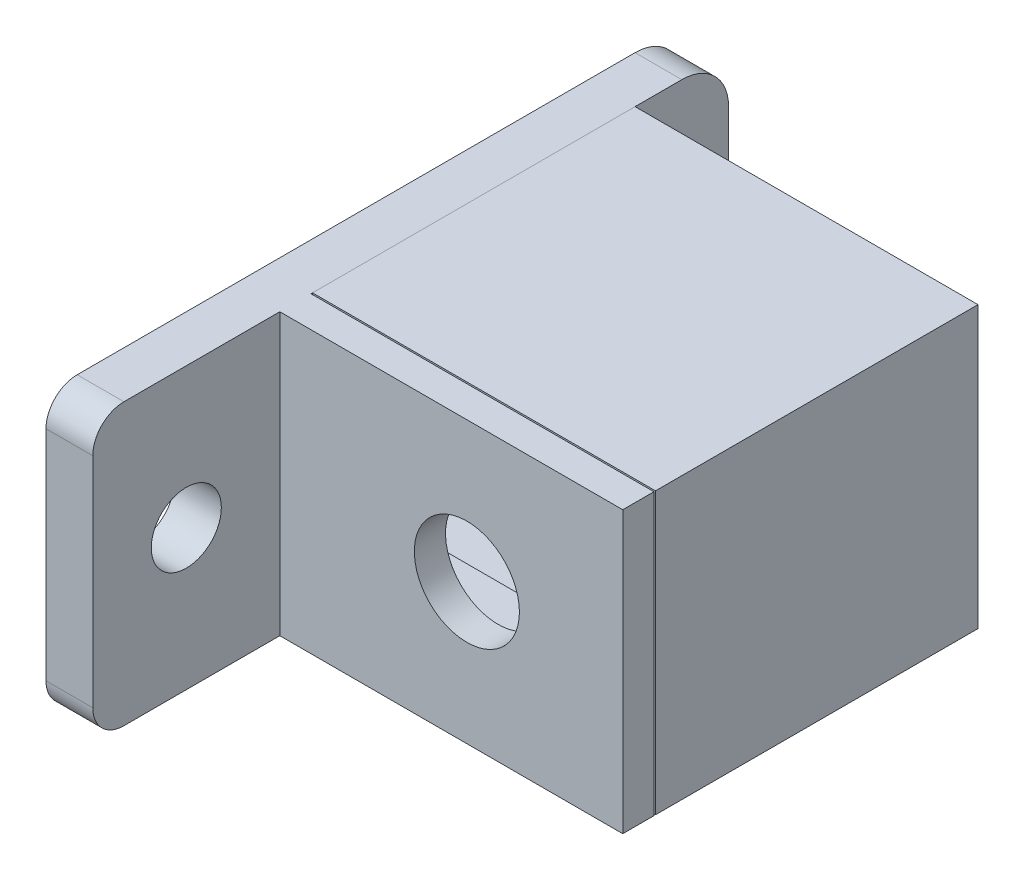
from build123d import *

# Parameters (mm, degrees)
BOSS_EXTRUDE1_DEPTH      = 10
BOSS_EXTRUDE1_DEPTH_BACK = 15
SKETCH1_W                = 2
SKETCH1_H                = 18
SKETCH2_W                = 3
SKETCH2_H                = 18
BOSS_EXTRUDE2_DEPTH      = 20.79
BOSS_EXTRUDE3_DEPTH      = 22
SKETCH6_W                = 20.69
SKETCH6_H                = 18
BOSS_EXTRUDE4_DEPTH      = 3
CUT_EXTRUDE1_DEPTH       = 19
BOSS_EXTRUDE5_DEPTH      = 18.5
SKETCH7_R                = 3.75
CUT_EXTRUDE2_DEPTH       = 29.729498777
SKETCH8_R                = 3.37
CUT_EXTRUDE3_DEPTH       = 29.729498777
BOSS_EXTRUDE6_DEPTH      = 3
SKETCH13_W               = 3
SKETCH13_H               = 12
BOSS_EXTRUDE7_DEPTH      = 3
BOSS_EXTRUDE8_DEPTH      = 3
SKETCH17_W               = 2.2479
SKETCH17_H               = 6


with BuildPart() as part:
    # Sketch1 → Boss-Extrude1 (new, two sides: drawn at the far end of the back side and taken through both)
    with BuildSketch(Plane(origin=(0, 0, 0), x_dir=(0, 0, -1), z_dir=(1, 0, 0)).offset(-BOSS_EXTRUDE1_DEPTH_BACK)):
        with Locations((-12.46, 0)):
            Rectangle(SKETCH1_W, SKETCH1_H)
    extrude(amount=BOSS_EXTRUDE1_DEPTH + BOSS_EXTRUDE1_DEPTH_BACK)

    # Sketch2 → Boss-Extrude2 (add)
    with BuildSketch(Plane(origin=(0, 0, 11.46), x_dir=(-1, 0, 0), z_dir=(0, 0, -1))):
        with Locations((13.5, 0)):
            Rectangle(SKETCH2_W, SKETCH2_H)
    extrude(amount=BOSS_EXTRUDE2_DEPTH)

    # Sketch4 → Boss-Extrude5 (add)
    with BuildSketch(Plane(origin=(-12, 0, 0), x_dir=(0, 0, -1), z_dir=(1, 0, 0))):
        Polygon((-11.46, 6.5), (-9.46, 6.5), (-7.96, 8), (-7.96, 4.5), (-11.46, 4.5), align=None)
        Polygon((-7.96, -4.5), (-11.46, -4.5), (-11.46, -6.5), (-9.46, -6.5), (-7.96, -8), align=None)
    extrude(amount=BOSS_EXTRUDE5_DEPTH)

    # Sketch8 → Cut-Extrude3 (cut, through all)
    with BuildSketch(Plane.XY.offset(13.46)):
        Circle(SKETCH8_R)
    extrude(amount=-CUT_EXTRUDE3_DEPTH, mode=Mode.SUBTRACT)

    # Sketch9 → Boss-Extrude6 (add)
    with BuildSketch(Plane.ZY.offset(15)):
        with BuildLine():
            Line((-9.33, -9), (-12.33, -9))
            ThreePointArc((-12.33, -9), (-14.451320344, -8.121320344), (-15.33, -6))
            Line((-15.33, -6), (-15.33, 6))
            ThreePointArc((-15.33, 6), (-14.451320344, 8.121320344), (-12.33, 9))
            Line((-12.33, 9), (-9.33, 9))
            Line((-9.33, 9), (-9.33, -9))
        make_face()
    extrude(amount=-BOSS_EXTRUDE6_DEPTH)

    # Sketch13 → Boss-Extrude7 (add)
    with BuildSketch(Plane.ZY.offset(15)):
        with Locations((-10.83, 0)):
            Rectangle(SKETCH13_W, SKETCH13_H)
    extrude(amount=BOSS_EXTRUDE7_DEPTH)

    # Sketch14 → Boss-Extrude8 (add)
    with BuildSketch(Plane.ZY.offset(15)):
        with BuildLine():
            Line((13.46, -9), (13.46, 9))
            Line((13.46, 9), (23.46, 9))
            ThreePointArc((23.46, 9), (24.874213562, 8.414213562), (25.46, 7))
            Line((25.46, 7), (25.46, -7))
            ThreePointArc((25.46, -7), (24.874213562, -8.414213562), (23.46, -9))
            Line((23.46, -9), (13.46, -9))
        make_face()
    extrude(amount=-BOSS_EXTRUDE8_DEPTH)

    # Sketch17 → #8 Clearance Hole1 (revolve, cut)
    with BuildSketch(Plane(origin=(-12, 0, 19.46), x_dir=(0, 0, -1), z_dir=(0, 1, 0))):
        with Locations((1.12395, 3)):
            Rectangle(SKETCH17_W, SKETCH17_H)
    revolve(axis=Axis((-5.65, 0, 19.46), (-1, 0, 0)), mode=Mode.SUBTRACT)


with BuildPart() as body_2:
    # Sketch3 → Boss-Extrude3 (new body)
    with BuildSketch(Plane(origin=(-12, 0, 0), x_dir=(0, 0, -1), z_dir=(1, 0, 0))):
        Polygon((-11.36, 9), (-11.36, 7), (7.33, 7), (7.33, -7), (-11.36, -7), (-11.36, -9), (9.33, -9), (9.33, 9), align=None)
    extrude(amount=BOSS_EXTRUDE3_DEPTH)

    # Sketch6 → Boss-Extrude4 (add)
    with BuildSketch(Plane(origin=(10, 0, 0), x_dir=(0, 0, -1), z_dir=(1, 0, 0))):
        with Locations((-1.015, 0)):
            Rectangle(SKETCH6_W, SKETCH6_H)
    extrude(amount=-BOSS_EXTRUDE4_DEPTH)

    # Sketch5 → Cut-Extrude1 (cut)
    with BuildSketch(Plane(origin=(-12, 0, 0), x_dir=(0, 0, -1), z_dir=(1, 0, 0))):
        Polygon((-9.101421356, 7), (-7.86, 8.241421356), (-7.86, 7), align=None)
        Polygon((-7.86, -8.241421356), (-7.86, -7), (-9.101421356, -7), align=None)
    extrude(amount=CUT_EXTRUDE1_DEPTH, mode=Mode.SUBTRACT)

    # Sketch7 → Cut-Extrude2 (cut, through all)
    with BuildSketch(Plane(origin=(0, 0, -9.33), x_dir=(-1, 0, 0), z_dir=(0, 0, -1))):
        with Locations((12, 0)):
            Circle(SKETCH7_R)
    extrude(amount=-CUT_EXTRUDE2_DEPTH, mode=Mode.SUBTRACT)


solid = Compound([part.part, body_2.part])
